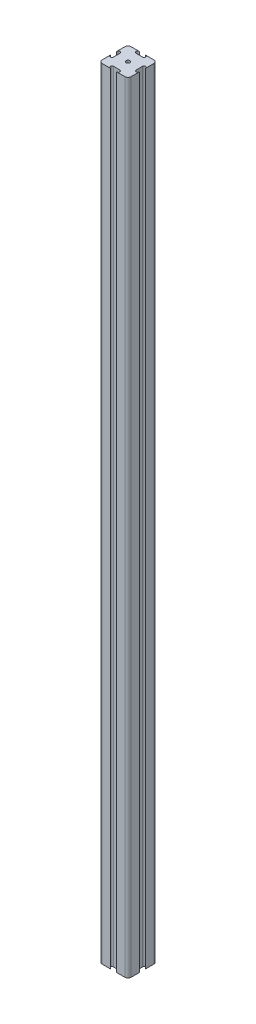
from build123d import *

# Parameters (mm, degrees)
BOSS_EXTRU_2_DEPTH      = 1210
ESQUISSE5_R             = 3
ENL_V_MAT_EXTRU_1_DEPTH = 1211.418316121


with BuildPart() as part:
    # Esquisse4 → Boss.-Extru.2 (new body)
    with BuildSketch(Plane(origin=(0, 0, 0), x_dir=(1, 0, 0), z_dir=(0, 1, 0))):
        with BuildLine():
            Line((-17.5, 22.5), (-5, 22.5))
            ThreePointArc((-5, 22.5), (-7.5, 20), (-5, 17.5))
            Line((-5, 17.5), (5, 17.5))
            ThreePointArc((5, 17.5), (7.5, 20), (5, 22.5))
            Line((5, 22.5), (17.5, 22.5))
            ThreePointArc((17.5, 22.5), (21.035534799, 21.035533013), (22.5, 17.499997475))
            Line((22.5, 17.499997475), (22.5, 4.999997475))
            ThreePointArc((22.5, 4.999997475), (20, 7.499997475), (17.5, 4.999997475))
            Line((17.5, 4.999997475), (17.5, -5.000002525))
            ThreePointArc((17.5, -5.000002525), (20, -7.500002525), (22.5, -5.000002525))
            Line((22.5, -5.000002525), (22.5, -17.500002525))
            ThreePointArc((22.5, -17.500002525), (21.035533013, -21.035534799), (17.5, -22.5))
            Line((17.5, -22.5), (5, -22.5))
            ThreePointArc((5, -22.5), (7.5, -20), (5, -17.5))
            Line((5, -17.5), (-5, -17.5))
            ThreePointArc((-5, -17.5), (-7.5, -20), (-5, -22.5))
            Line((-5, -22.5), (-17.5, -22.5))
            ThreePointArc((-17.5, -22.5), (-21.035533906, -21.035533906), (-22.5, -17.5))
            Line((-22.5, -17.5), (-22.5, -5))
            ThreePointArc((-22.5, -5), (-20, -7.5), (-17.5, -5))
            Line((-17.5, -5), (-17.5, 5))
            ThreePointArc((-17.5, 5), (-20, 7.5), (-22.5, 5))
            Line((-22.5, 5), (-22.5, 17.5))
            ThreePointArc((-22.5, 17.5), (-21.035533906, 21.035533906), (-17.5, 22.5))
        make_face()
    extrude(amount=BOSS_EXTRU_2_DEPTH)

    # Esquisse5 → Enlèv. mat.-Extru.1 (cut, through all)
    with BuildSketch(Plane.XZ):
        with Locations(Location((0, 0, 0), (0, 0, 270))):
            Circle(ESQUISSE5_R)
    extrude(amount=-ENL_V_MAT_EXTRU_1_DEPTH, mode=Mode.SUBTRACT)


solid = part.part
